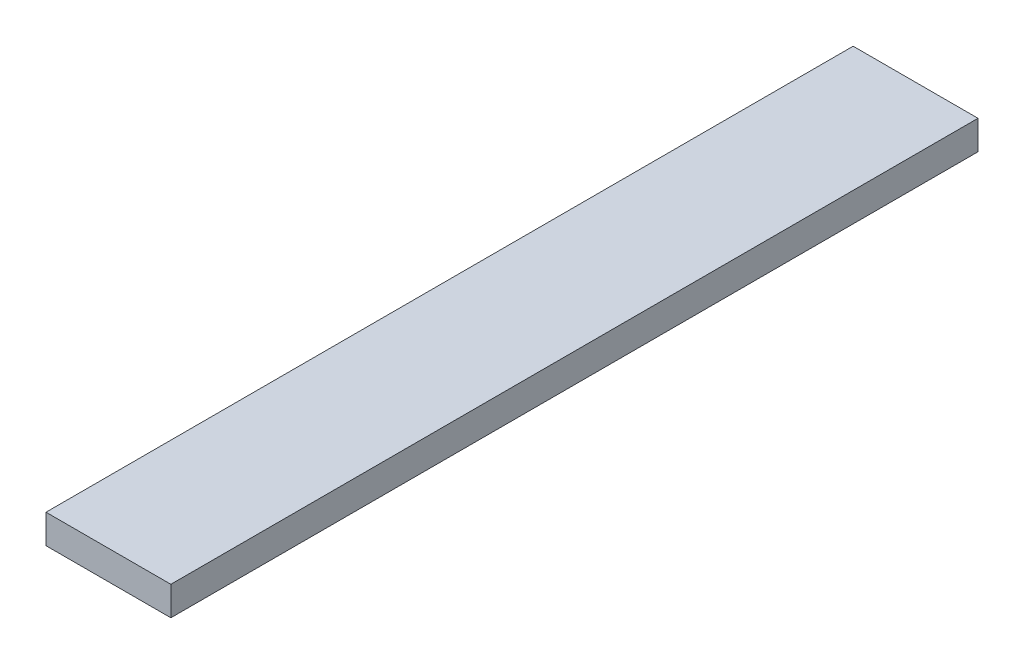
from build123d import *

# Parameters (mm, degrees)
BASE_SKETCH_W       = 50.8
BASE_SKETCH_H       = 328.42
BOSS_EXTRUDE1_DEPTH = 11.81


with BuildPart() as part:
    # Base_Sketch → Boss-Extrude1 (new body)
    with BuildSketch(Plane(origin=(0, 0, 0), x_dir=(1, 0, 0), z_dir=(0, 1, 0))):
        Rectangle(BASE_SKETCH_W, BASE_SKETCH_H)
    extrude(amount=BOSS_EXTRUDE1_DEPTH)


solid = part.part
